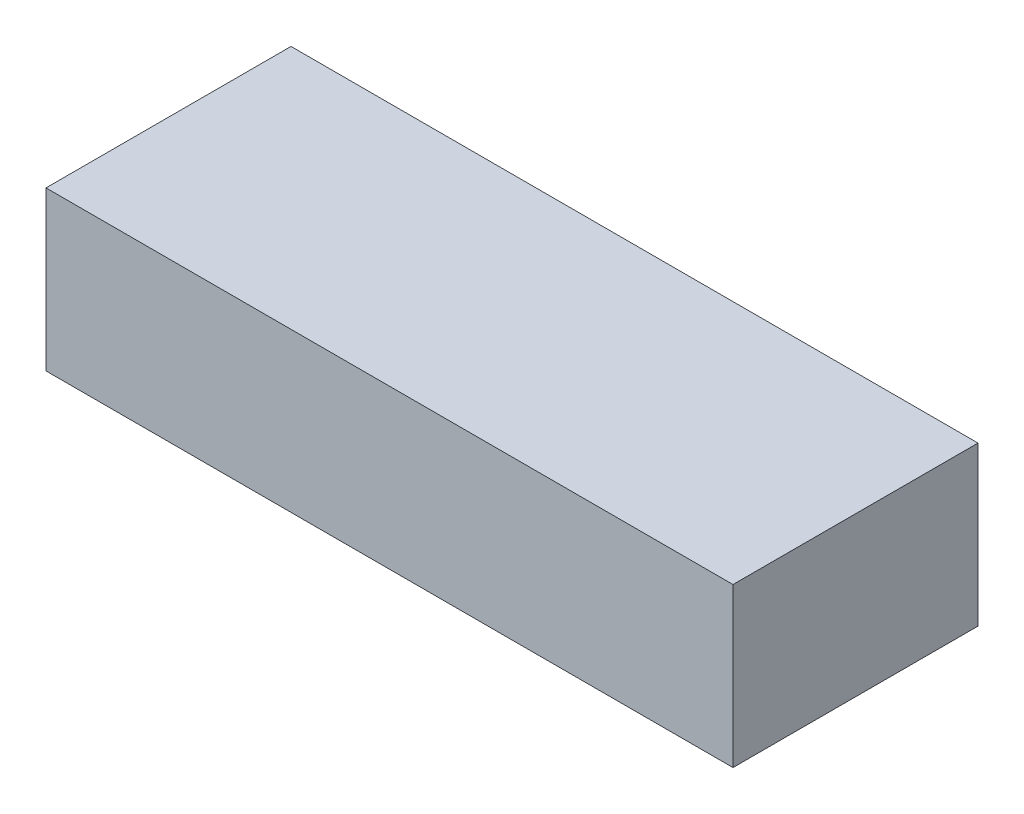
from build123d import *

# Parameters (mm, degrees)
SKETCH1_W           = 143
SKETCH1_H           = 51
BOSS_EXTRUDE1_DEPTH = 33


with BuildPart() as part:
    # Sketch1 → Boss-Extrude1 (new body)
    with BuildSketch(Plane(origin=(0, 0, 0), x_dir=(1, 0, 0), z_dir=(0, 1, 0))):
        Rectangle(SKETCH1_W, SKETCH1_H)
    extrude(amount=BOSS_EXTRUDE1_DEPTH)


solid = part.part
